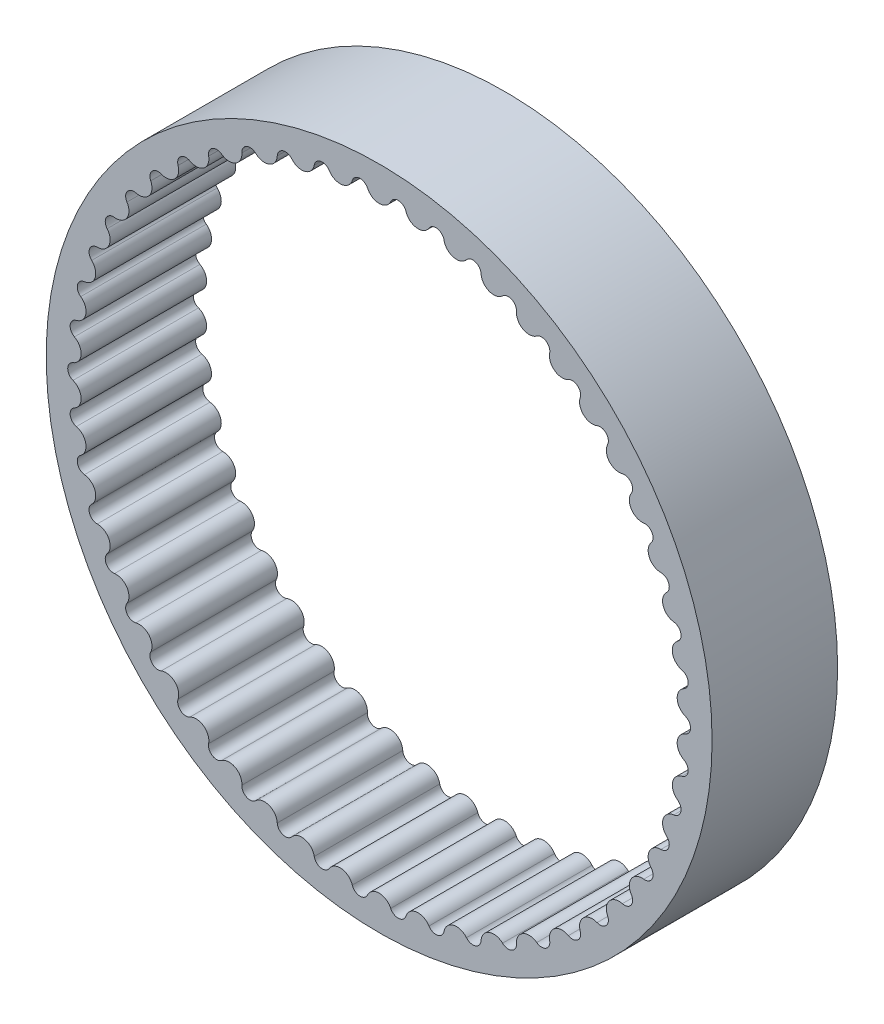
from build123d import *

# Parameters (mm, degrees)
SKETCH2_R           = 15.915507752
SKETCH2_R_2         = 14.275507752
BOSS_EXTRUDE1_DEPTH = 3
CUT_EXTRUDE1_DEPTH  = 23.70697633
CIRPATTERN3_COUNT   = 50


with BuildPart() as part:
    # Sketch2 → Boss-Extrude1 (new, symmetric)
    with BuildSketch(Plane.XY):
        Circle(SKETCH2_R)
        Circle(SKETCH2_R_2, mode=Mode.SUBTRACT)
    extrude(amount=BOSS_EXTRUDE1_DEPTH, both=True)

    # Sketch3 → Cut-Extrude1 (cut, symmetric)
    with BuildSketch(Plane.XY):
        with BuildLine():
            ThreePointArc((1.789195547, 14.16294111), (0.896366548, 14.247338299), (0, 14.275507752))
            ThreePointArc((0, 14.275507752), (0.328422523, 14.37146627), (0.55351738, 14.629151536))
            ThreePointArc((0.55351738, 14.629151536), (0.934668765, 14.856134603), (1.284366136, 14.583170429))
            ThreePointArc((1.284366136, 14.583170429), (1.475389525, 14.299305222), (1.789195547, 14.16294111))
        make_face()
    cut_extrude1 = extrude(amount=CUT_EXTRUDE1_DEPTH, both=True, mode=Mode.SUBTRACT)

    # CirPattern3: Cut-Extrude1 ×50 about axis
    cirpattern3_axis = Axis((0, 0, 3), (0, 0, -1))
    for i in range(1, CIRPATTERN3_COUNT):
        add(cut_extrude1.rotate(cirpattern3_axis, i * 360 / CIRPATTERN3_COUNT), mode=Mode.SUBTRACT)


solid = part.part
